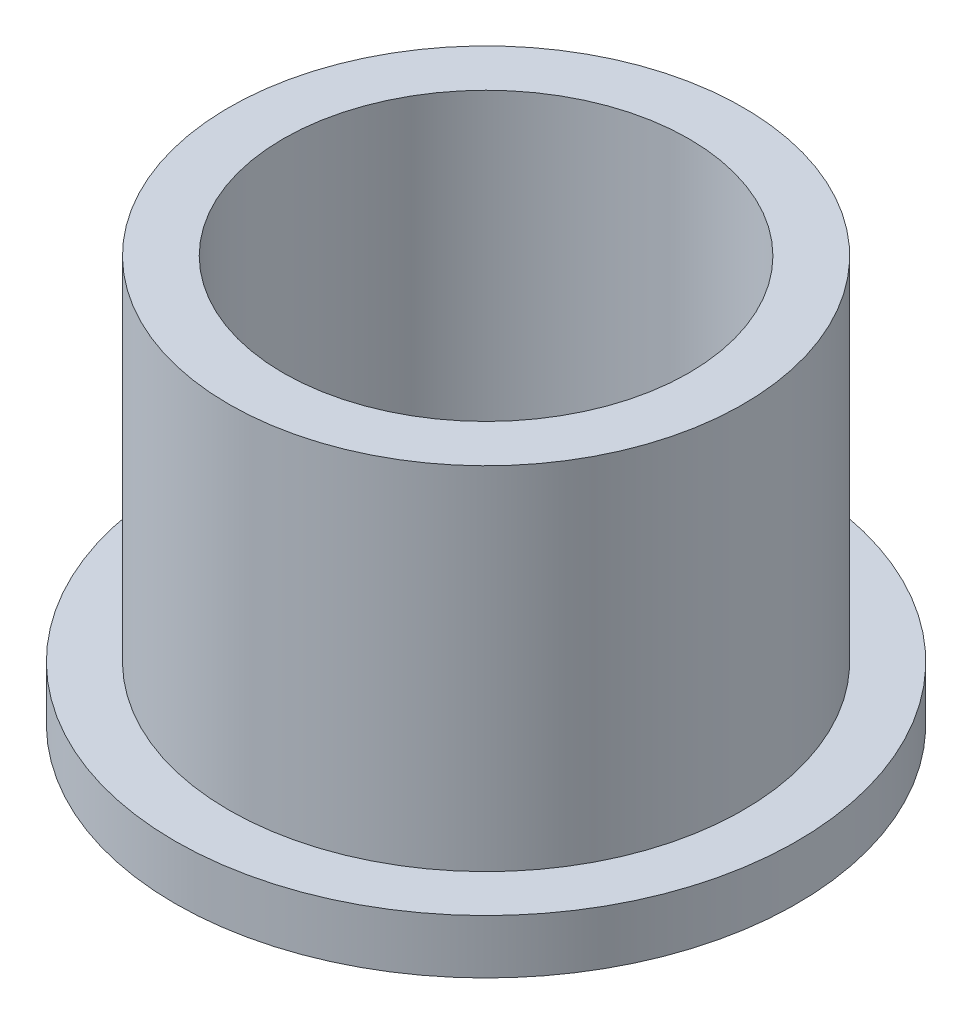
from build123d import *

# Parameters (mm, degrees)
SKETCH2_R           = 19.02
SKETCH2_R_2         = 15.005
BOSS_EXTRUDE1_DEPTH = 30
SKETCH3_R           = 23
SKETCH3_R_2         = 19.02
BOSS_EXTRUDE2_DEPTH = 4


with BuildPart() as part:
    # Sketch2 → Boss-Extrude1 (new body)
    with BuildSketch(Plane(origin=(0, 0, 0), x_dir=(1, 0, 0), z_dir=(0, 1, 0))):
        with Locations(Location((0, 0, 0), (0, 0, 270))):
            Circle(SKETCH2_R)
        with Locations(Location((0, 0, 0), (0, 0, 270))):
            Circle(SKETCH2_R_2, mode=Mode.SUBTRACT)
    extrude(amount=BOSS_EXTRUDE1_DEPTH)

    # Sketch3 → Boss-Extrude2 (add)
    with BuildSketch(Plane(origin=(0, 0, 0), x_dir=(1, 0, 0), z_dir=(0, 1, 0))):
        with Locations(Location((0, 0, 0), (0, 0, 270))):
            Circle(SKETCH3_R)
        with Locations(Location((0, 0, 0), (0, 0, 270))):
            Circle(SKETCH3_R_2, mode=Mode.SUBTRACT)
    extrude(amount=BOSS_EXTRUDE2_DEPTH)


solid = part.part
